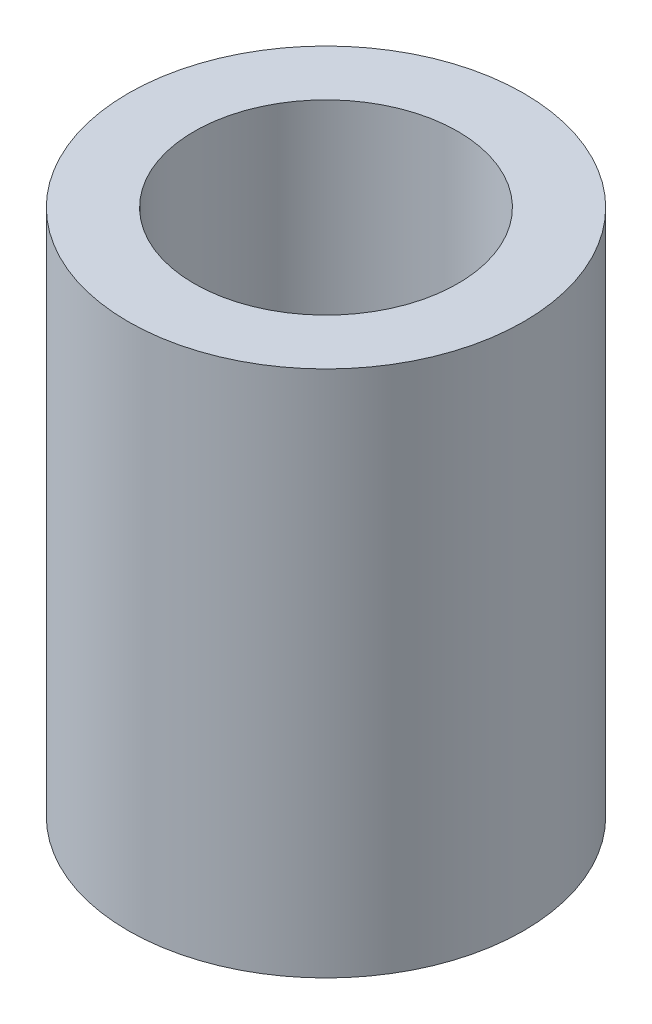
from build123d import *

# Parameters (mm, degrees)
SKETCH1_R           = 3
SKETCH1_R_2         = 2
BOSS_EXTRUDE1_DEPTH = 8


with BuildPart() as part:
    # Sketch1 → Boss-Extrude1 (new body)
    with BuildSketch(Plane(origin=(0, 0, 0), x_dir=(1, 0, 0), z_dir=(0, 1, 0))):
        with Locations(Location((0, 0, 0), (0, 0, 270))):
            Circle(SKETCH1_R)
        with Locations(Location((0, 0, 0), (0, 0, 270))):
            Circle(SKETCH1_R_2, mode=Mode.SUBTRACT)
    extrude(amount=BOSS_EXTRUDE1_DEPTH)


solid = part.part
